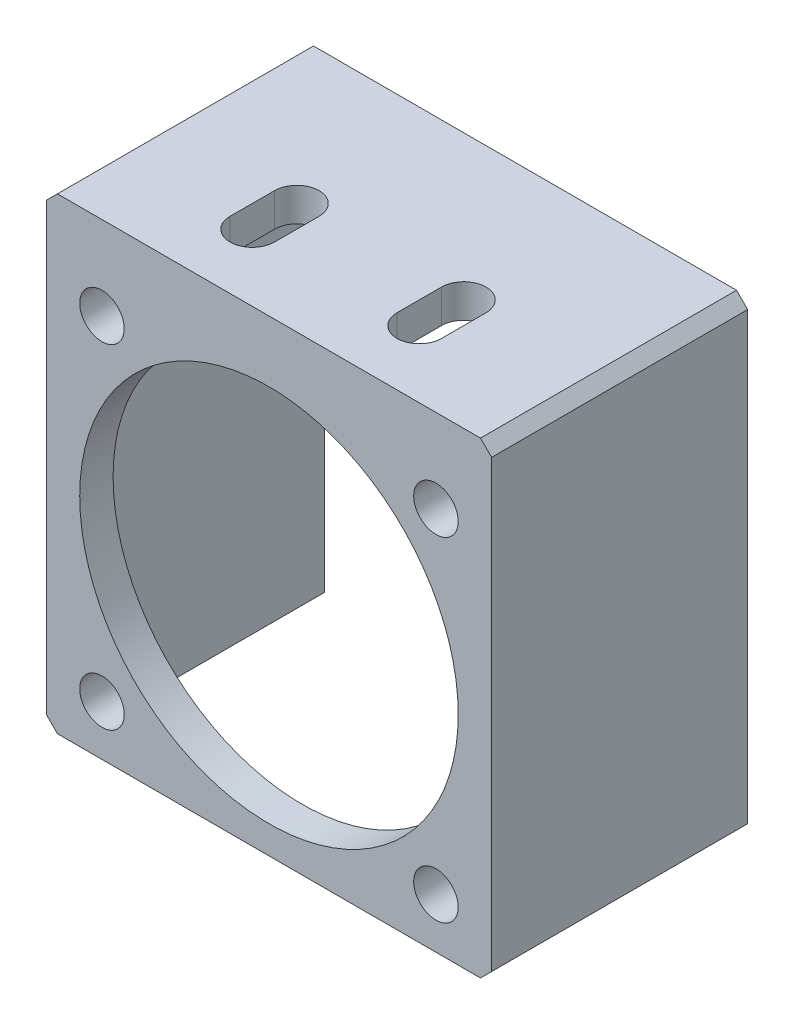
from build123d import *

# Parameters (mm, degrees)
SKETCH_1_W          = 40
SKETCH_1_H          = 42
SKETCH_1_R          = 2
SKETCH_1_R_2        = 17
EXTRUDE_1_DEPTH     = 3
EXTRUDE_2_DEPTH     = 20
CUT_EXTRUDE_1_DEPTH = 25
CUT_EXTRUDE_2_DEPTH = 4


with BuildPart() as part:
    # 草图1 → 凸台-拉伸1 (new body)
    with BuildSketch(Plane.XY):
        with Locations((-26.203389279, 21.300914244)):
            Rectangle(SKETCH_1_W, SKETCH_1_H)
        with Locations((-41.203389279, 34.800914244)):
            Circle(SKETCH_1_R, mode=Mode.SUBTRACT)
        with Locations((-11.203389279, 34.800914244)):
            Circle(SKETCH_1_R, mode=Mode.SUBTRACT)
        with Locations((-41.203389279, 4.800914244)):
            Circle(SKETCH_1_R, mode=Mode.SUBTRACT)
        with Locations((-11.203389279, 4.800914244)):
            Circle(SKETCH_1_R, mode=Mode.SUBTRACT)
        with Locations((-26.203389279, 19.800914244)):
            Circle(SKETCH_1_R_2, mode=Mode.SUBTRACT)
    extrude(amount=EXTRUDE_1_DEPTH)

    # 草图2 → 凸台-拉伸2 (add)
    with BuildSketch(Plane(origin=(0, 0, 0), x_dir=(-1, 0, 0), z_dir=(0, 0, -1))):
        Polygon((6.203389279, 42.300914244), (46.203389279, 42.300914244), (46.203389279, 0.300914244), (44.203389279, 0.300914244), (44.203389279, 39.300914244), (8.203389279, 39.300914244), (8.203389279, 0.300914244), (6.203389279, 0.300914244), align=None)
    extrude(amount=EXTRUDE_2_DEPTH)

    # 草图3 → 切除-拉伸1 (cut)
    with BuildSketch(Plane.XY.offset(3)):
        Polygon((-45.203389279, 42.300914244), (-46.203389279, 42.300914244), (-46.203389279, 41.300914244), align=None)
        Polygon((-6.203389279, 42.300914244), (-7.203389279, 42.300914244), (-6.203389279, 41.300914244), align=None)
        Polygon((-45.203389279, 0.300914244), (-46.203389279, 1.300914244), (-46.203389279, 0.300914244), align=None)
        Polygon((-6.203389279, 0.300914244), (-6.203389279, 1.300914244), (-7.203389279, 0.300914244), align=None)
    extrude(amount=-CUT_EXTRUDE_1_DEPTH, mode=Mode.SUBTRACT)

    # 草图5 → 切除-拉伸2 (cut)
    with BuildSketch(Plane(origin=(0, 42.300914244, 0), x_dir=(1, 0, 0), z_dir=(0, 1, 0))):
        with BuildLine():
            Line((-35.703389279, 7), (-35.703389279, 3))
            ThreePointArc((-35.703389279, 3), (-33.703389279, 1), (-31.703389279, 3))
            Line((-31.703389279, 3), (-31.703389279, 7))
            ThreePointArc((-31.703389279, 7), (-33.703389279, 9), (-35.703389279, 7))
        make_face()
        with BuildLine():
            Line((-20.703389279, 7), (-20.703389279, 3))
            ThreePointArc((-20.703389279, 3), (-18.703389279, 1), (-16.703389279, 3))
            Line((-16.703389279, 3), (-16.703389279, 7))
            ThreePointArc((-16.703389279, 7), (-18.703389279, 9), (-20.703389279, 7))
        make_face()
    extrude(amount=-CUT_EXTRUDE_2_DEPTH, mode=Mode.SUBTRACT)


solid = part.part
